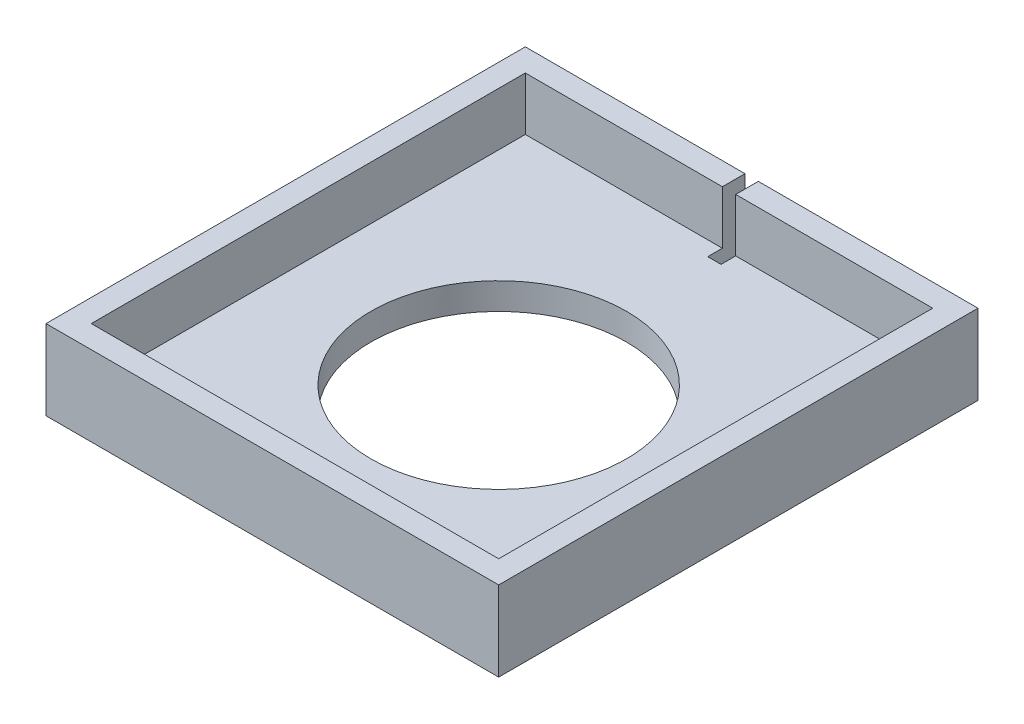
from build123d import *

# Parameters (mm, degrees)
SKETCH1_W           = 34
SKETCH1_H           = 36
BOSS_EXTRUDE1_DEPTH = 6
SKETCH2_W           = 30.6
SKETCH2_H           = 32.6
CUT_EXTRUDE1_DEPTH  = 4
SKETCH3_R           = 9.6
CUT_EXTRUDE2_DEPTH  = 50.879855653
SKETCH4_W           = 1
SKETCH4_H           = 2.8
CUT_EXTRUDE3_DEPTH  = 50.879855653


with BuildPart() as part:
    # Sketch1 → Boss-Extrude1 (new body)
    with BuildSketch(Plane(origin=(0, 0, 0), x_dir=(1, 0, 0), z_dir=(0, 1, 0))):
        with Locations((17, 18)):
            Rectangle(SKETCH1_W, SKETCH1_H)
    extrude(amount=BOSS_EXTRUDE1_DEPTH)

    # Sketch2 → Cut-Extrude1 (cut)
    with BuildSketch(Plane(origin=(0, 6, 0), x_dir=(1, 0, 0), z_dir=(0, 1, 0))):
        with Locations((17, 18)):
            Rectangle(SKETCH2_W, SKETCH2_H)
    extrude(amount=-CUT_EXTRUDE1_DEPTH, mode=Mode.SUBTRACT)

    # Sketch3 → Cut-Extrude2 (cut, through all)
    with BuildSketch(Plane.XZ):
        with Locations(Location((17, -17, 0), (0, 0, 270))):
            Circle(SKETCH3_R)
    extrude(amount=-CUT_EXTRUDE2_DEPTH, mode=Mode.SUBTRACT)

    # Sketch4 → Cut-Extrude3 (cut, through all)
    with BuildSketch(Plane.XZ):
        with Locations((17, -34.6)):
            Rectangle(SKETCH4_W, SKETCH4_H)
    extrude(amount=-CUT_EXTRUDE3_DEPTH, mode=Mode.SUBTRACT)


solid = part.part
